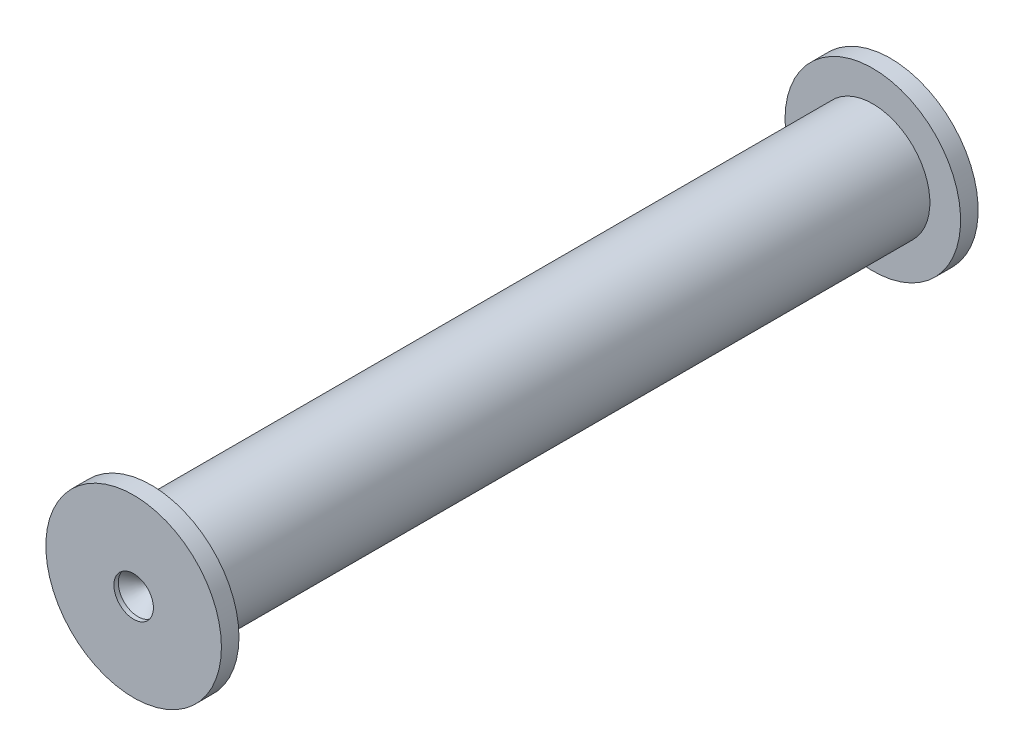
from build123d import *

# Parameters (mm, degrees)
Y_KSEKLIK_EKSTR_ZYON1_DEPTH      = 0.1
Y_KSEKLIK_EKSTR_ZYON1_DEPTH_BACK = 16.34
IZIM1_R                          = 1.3
IZIM2_R                          = 2
Y_KSEKLIK_EKSTR_ZYON2_DEPTH      = 0.4
Y_KSEKLIK_EKSTR_ZYON3_START      = 0.4
IZIM3_R                          = 2
Y_KSEKLIK_EKSTR_ZYON3_DEPTH      = 0.4
IZIM4_R                          = 0.45
KES_EKSTR_ZYON1_DEPTH            = 0.5
PAH1_SIZE                        = 0.4
KES_EKSTR_ZYON2_START            = -0.5
IZIM5_R                          = 0.45
KES_EKSTR_ZYON2_DEPTH            = 0.5
PAH2_SIZE                        = 0.4


with BuildPart() as part:
    # Çizim1 → Yükseklik-Ekstrüzyon1 (new, two sides: drawn at the far end of the back side and taken through both)
    with BuildSketch(Plane.XY.offset(-Y_KSEKLIK_EKSTR_ZYON1_DEPTH_BACK)):
        with Locations((3.3, -31.281939442)):
            Circle(IZIM1_R)
    extrude(amount=Y_KSEKLIK_EKSTR_ZYON1_DEPTH + Y_KSEKLIK_EKSTR_ZYON1_DEPTH_BACK)

    # Çizim2 → Yükseklik-Ekstrüzyon2 (add)
    with BuildSketch(Plane.XY.offset(0.1)):
        with Locations((3.3, -31.281939442)):
            Circle(IZIM2_R)
    extrude(amount=Y_KSEKLIK_EKSTR_ZYON2_DEPTH)

    # Çizim3 → Yükseklik-Ekstrüzyon3 (add)
    with BuildSketch(Plane(origin=(0, 0, -16.34), x_dir=(-1, 0, 0), z_dir=(0, 0, -1)).offset(Y_KSEKLIK_EKSTR_ZYON3_START)):
        with Locations(Location((-3.3, -31.281939442, 0), (0, 0, 180))):
            Circle(IZIM3_R)
    extrude(amount=-Y_KSEKLIK_EKSTR_ZYON3_DEPTH)

    # Çizim4 → Kes-Ekstrüzyon1 (cut)
    with BuildSketch(Plane(origin=(0, 0, -16.74), x_dir=(-1, 0, 0), z_dir=(0, 0, -1))):
        with Locations((-3.3, -31.281939442)):
            Circle(IZIM4_R)
    extrude(amount=-KES_EKSTR_ZYON1_DEPTH, mode=Mode.SUBTRACT)

    # Pah1
    pah1_edges = [part.edges().sort_by_distance(p)[0] for p in [
        (3.75, -31.281939442, -16.24),
    ]]
    chamfer(pah1_edges, length=PAH1_SIZE)

    # Çizim5 → Kes-Ekstrüzyon2 (cut)
    with BuildSketch(Plane.XY.offset(0.5).offset(KES_EKSTR_ZYON2_START)):
        with Locations(Location((3.3, -31.281939442, 0), (0, 0, 180))):
            Circle(IZIM5_R)
    extrude(amount=KES_EKSTR_ZYON2_DEPTH, mode=Mode.SUBTRACT)

    # Pah2
    pah2_edges = [part.edges().sort_by_distance(p)[0] for p in [
        (3.75, -31.281939442, 0),
    ]]
    chamfer(pah2_edges, length=PAH2_SIZE)


solid = part.part
